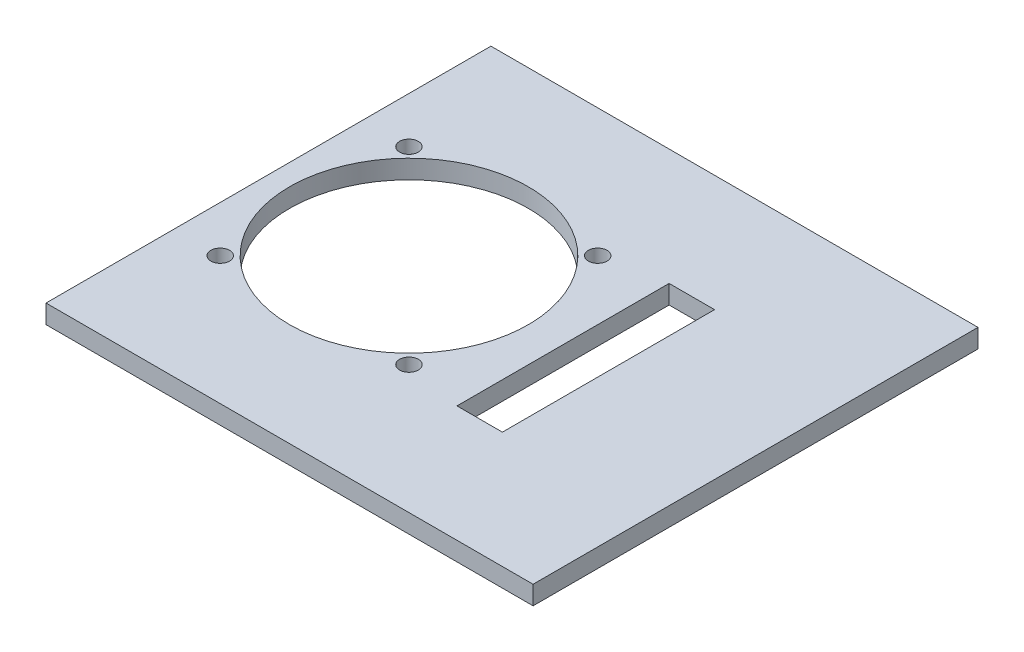
from build123d import *

# Parameters (mm, degrees)
SKETCH1_W           = 104
SKETCH1_H           = 95
SKETCH1_R           = 25.5
SKETCH1_R_2         = 2
SKETCH1_W_2         = 9.7
SKETCH1_H_2         = 45.3
BOSS_EXTRUDE1_DEPTH = 4


with BuildPart() as part:
    # Sketch1 → Boss-Extrude1 (new body)
    with BuildSketch(Plane(origin=(0, 0, 0), x_dir=(1, 0, 0), z_dir=(0, 1, 0))):
        with Locations((32.920457223, -35.53611465)):
            Rectangle(SKETCH1_W, SKETCH1_H)
        with Locations(Location((10.920457223, -35.53611465, 0), (0, 0, 270))):
            Circle(SKETCH1_R, mode=Mode.SUBTRACT)
        with Locations(Location((-9.229542777, -15.38611465, 0), (0, 0, 270))):
            Circle(SKETCH1_R_2, mode=Mode.SUBTRACT)
        with Locations(Location((-9.229542777, -55.68611465, 0), (0, 0, 270))):
            Circle(SKETCH1_R_2, mode=Mode.SUBTRACT)
        with Locations(Location((31.070457223, -55.68611465, 0), (0, 0, 270))):
            Circle(SKETCH1_R_2, mode=Mode.SUBTRACT)
        with Locations(Location((31.070457223, -15.38611465, 0), (0, 0, 270))):
            Circle(SKETCH1_R_2, mode=Mode.SUBTRACT)
        with Locations((48.670457223, -35.53611465)):
            Rectangle(SKETCH1_W_2, SKETCH1_H_2, mode=Mode.SUBTRACT)
    extrude(amount=BOSS_EXTRUDE1_DEPTH)


solid = part.part
